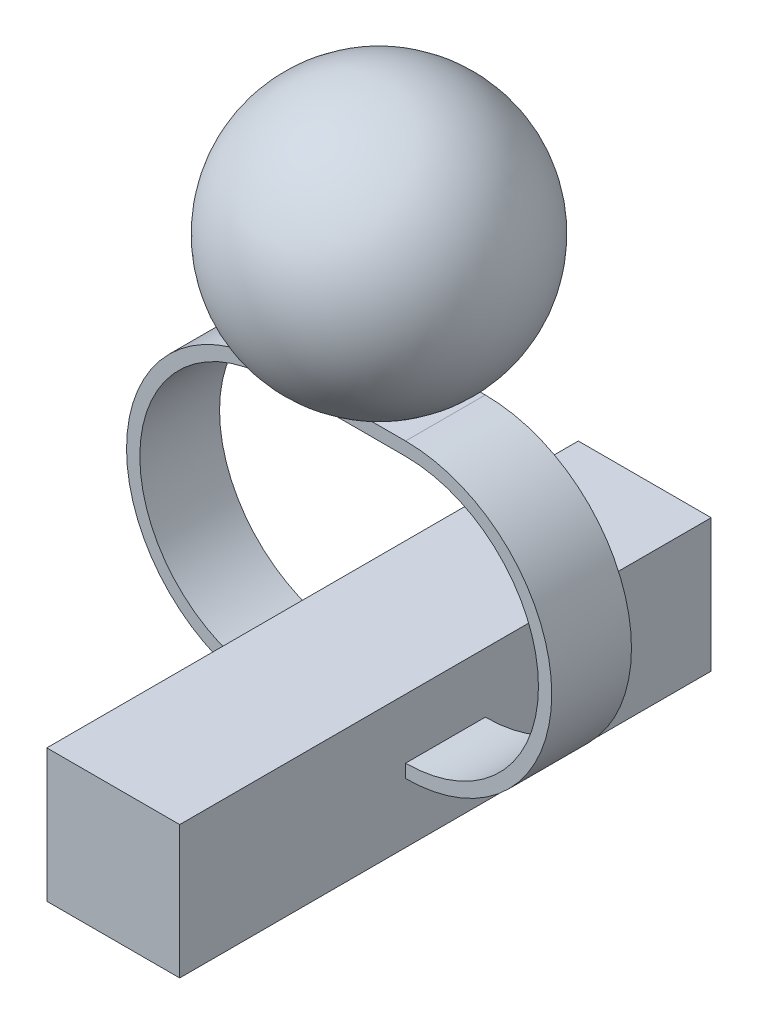
from build123d import *

# Parameters (mm, degrees)
SKETCH1_W           = 5
SKETCH1_H           = 5
BOSS_EXTRUDE1_DEPTH = 10
BOSS_EXTRUDE2_DEPTH = 1.5


with BuildPart() as part:
    # Sketch1 → Boss-Extrude1 (new, symmetric)
    with BuildSketch(Plane.XY):
        Rectangle(SKETCH1_W, SKETCH1_H)
    extrude(amount=BOSS_EXTRUDE1_DEPTH, both=True)

    # Sketch2 → Boss-Extrude2 (add, symmetric)
    with BuildSketch(Plane.XY):
        with BuildLine():
            Line((0, 0.25), (-2.5, 0.25))
            ThreePointArc((-2.5, 0.25), (-7.5, 5.25), (-2.5, 10.25))
            Line((-2.5, 10.25), (0, 10.25))
            Line((0, 10.25), (0, 10.75))
            Line((0, 10.75), (-2.5, 10.75))
            ThreePointArc((-2.5, 10.75), (-8, 5.25), (-2.5, -0.25))
            Line((-2.5, -0.25), (0, -0.25))
            Line((0, -0.25), (0, 0.25))
        make_face()
    boss_extrude2 = extrude(amount=BOSS_EXTRUDE2_DEPTH, both=True)

    # Mirror1: Boss-Extrude2 across plane
    add(boss_extrude2.mirror(Plane(origin=(0, 0, 0), x_dir=(0, 0, 1), z_dir=(1, 0, 0))))

    # Sketch3 → Revolve3 (revolve)
    with BuildSketch(Plane.XY):
        with BuildLine():
            Line((0, 10.5), (0, 20.5))
            ThreePointArc((0, 20.5), (-5, 15.5), (0, 10.5))
        make_face()
    revolve(axis=Axis((0, 0, 0), (0, 1, 0)))


solid = part.part
